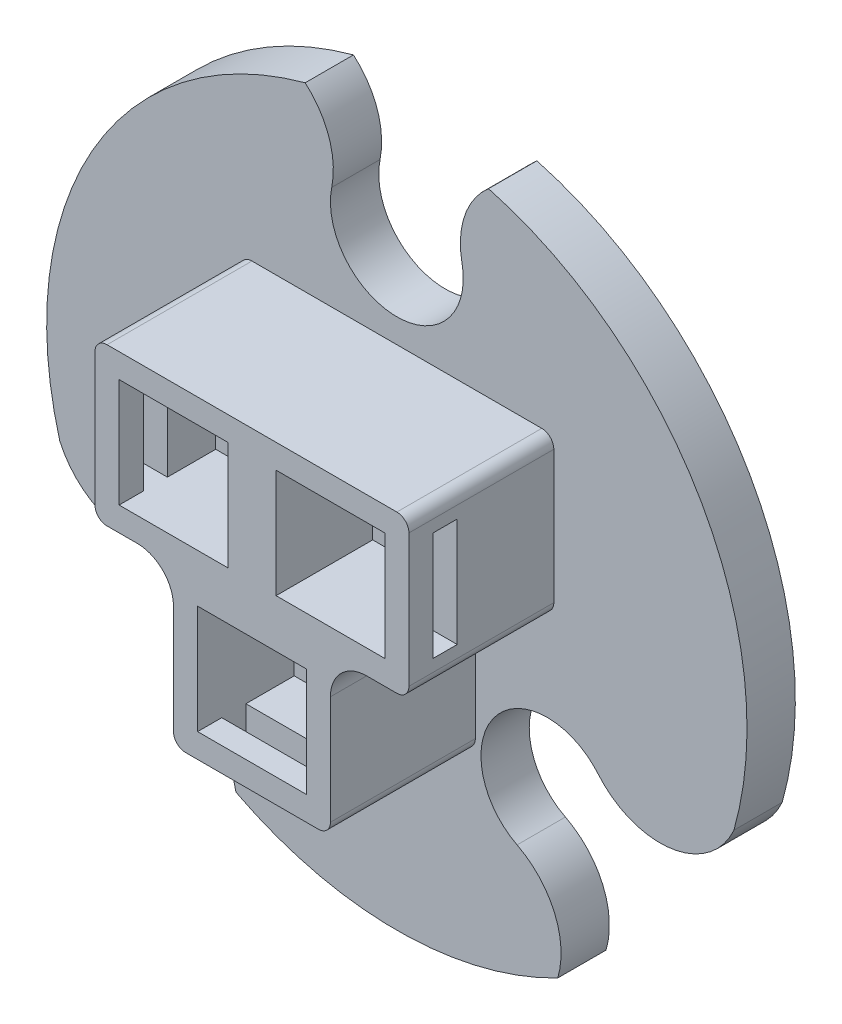
from build123d import *
from OCP.BRepFilletAPI import BRepFilletAPI_MakeFillet

# Parameters (mm, degrees)
SKETCH1_W           = 6.5
SKETCH1_H           = 6.5
BOSS_EXTRUDE1_DEPTH = 4
SKETCH5_W           = 6.5
SKETCH5_H           = 6.5
BOSS_EXTRUDE2_DEPTH = 8
SKETCH2_W           = 4.5
SKETCH2_H           = 4.5
CUT_EXTRUDE1_DEPTH  = 4
SKETCH10_W          = 1.75
SKETCH10_H          = 1.5
CUT_EXTRUDE3_DEPTH  = 11.024968828
FILLET7_R1          = 0.5
FILLET7_R2          = 1.5
BOSS_EXTRUDE3_DEPTH = 2
SKETCH12_W          = 1
SKETCH12_H          = 4.5
CUT_EXTRUDE4_DEPTH  = 5.5
SKETCH14_W          = 1
SKETCH14_H          = 4.5
CUT_EXTRUDE5_DEPTH  = 5.5
SKETCH15_W          = 4.5
SKETCH15_H          = 1
CUT_EXTRUDE6_DEPTH  = 5.5


with BuildPart() as part:
    # Sketch1 → Boss-Extrude1 (new, symmetric)
    with BuildSketch(Plane.XY):
        with Locations((3.25, 3.25)):
            Rectangle(SKETCH1_W, SKETCH1_H)
        with Locations((-3.25, 3.25)):
            Rectangle(SKETCH1_W, SKETCH1_H)
    extrude(amount=BOSS_EXTRUDE1_DEPTH, both=True)

    # Sketch5 → Boss-Extrude2 (add)
    with BuildSketch(Plane.XY.offset(4)):
        with Locations((0, -3.25)):
            Rectangle(SKETCH5_W, SKETCH5_H)
    extrude(amount=-BOSS_EXTRUDE2_DEPTH)

    # Sketch2 → Cut-Extrude1 (cut)
    with BuildSketch(Plane.XY.offset(4)):
        with Locations((3.25, 3.25)):
            Rectangle(SKETCH2_W, SKETCH2_H)
        with Locations((-3.25, 3.25)):
            Rectangle(SKETCH2_W, SKETCH2_H)
        with Locations((0, -3.25)):
            Rectangle(SKETCH2_W, SKETCH2_H)
    extrude(amount=-CUT_EXTRUDE1_DEPTH, mode=Mode.SUBTRACT)

    # Sketch10 → Cut-Extrude3 (cut, through all)
    with BuildSketch(Plane.XY):
        with Locations((1.875, 3.25)):
            Rectangle(SKETCH10_W, SKETCH10_H)
        with Locations((-4.625, 3.25)):
            Rectangle(SKETCH10_W, SKETCH10_H)
        with Locations((4.625, 3.25)):
            Rectangle(SKETCH10_W, SKETCH10_H)
        with Locations((-1.875, 3.25)):
            Rectangle(SKETCH10_W, SKETCH10_H)
        with Locations((-1.375, -3.25)):
            Rectangle(SKETCH10_W, SKETCH10_H)
        with Locations((1.375, -3.25)):
            Rectangle(SKETCH10_W, SKETCH10_H)
    extrude(amount=-CUT_EXTRUDE3_DEPTH, mode=Mode.SUBTRACT)

    # Fillet7: one fillet with a radius per group of edges: ONE call of the kernel's fillet builder (fillet() takes one radius for all edges)
    fillet7_edges_1 = [part.edges().sort_by_distance(p)[0] for p in [
        (-6.5, 0, 0),
        (-6.5, 6.5, 0),
        (6.5, 6.5, 0),
        (6.5, 0, 0),
        (-3.25, -6.5, 0),
        (3.25, -6.5, 0),
    ]]
    fillet7_edges_2 = [part.edges().sort_by_distance(p)[0] for p in [
        (-3.25, 0, 0),
        (3.25, 0, 0),
    ]]
    fillet7 = BRepFilletAPI_MakeFillet(part.part.solid().wrapped)
    for e in fillet7_edges_1:
        fillet7.Add(FILLET7_R1, e.wrapped)
    for e in fillet7_edges_2:
        fillet7.Add(FILLET7_R2, e.wrapped)
    add(Compound.cast(fillet7.Shape()), mode=Mode.REPLACE)

    # Sketch11 → Boss-Extrude3 (add)
    with BuildSketch(Plane.XY.offset(-4)):
        with BuildLine():
            ThreePointArc((-6.662391677, -12.878763029), (1.7135e-05, -14.5), (6.662422116, -12.878747282))
            ThreePointArc((6.662422116, -12.878747282), (6.529952292, -10.609320257), (4.978591095, -8.947656719))
            ThreePointArc((4.978591095, -8.947656719), (4.08034863, -4.787651774), (8.335817539, -4.728787212))
            ThreePointArc((8.335817539, -4.728787212), (11.36788446, -5.887108435), (13.95725976, -3.93))
            ThreePointArc((13.95725976, -3.93), (12.614166243, 7.150720942), (3.796390173, 13.994192426))
            ThreePointArc((3.796390173, 13.994192426), (2.811770094, 12.543018162), (2.695822199, 10.793178304))
            ThreePointArc((2.695822199, 10.793178304), (0, 7.5), (-2.695822199, 10.793178304))
            ThreePointArc((-2.695822199, 10.793178304), (-2.811770094, 12.543018162), (-3.796390173, 13.994192426))
            ThreePointArc((-3.796390173, 13.994192426), (-12.614205329, 7.150651992), (-13.957216796, -3.930152581))
            ThreePointArc((-13.957216796, -3.930152581), (-11.367821604, -5.887138898), (-8.335824842, -4.728795885))
            ThreePointArc((-8.335824842, -4.728795885), (-4.08035569, -4.787642902), (-4.978581003, -8.947651551))
            ThreePointArc((-4.978581003, -8.947651551), (-6.529938219, -10.609328183), (-6.662391677, -12.878763029))
        make_face()
        with BuildLine():
            Line((-3.25, -1.5), (-3.25, -6))
            ThreePointArc((-3.25, -6), (-3.103553391, -6.353553391), (-2.75, -6.5))
            Line((-2.75, -6.5), (2.75, -6.5))
            ThreePointArc((2.75, -6.5), (3.103553391, -6.353553391), (3.25, -6))
            Line((3.25, -6), (3.25, -1.5))
            ThreePointArc((3.25, -1.5), (3.689339828, -0.439339828), (4.75, 0))
            Line((4.75, 0), (6, 0))
            ThreePointArc((6, 0), (6.353553391, 0.146446609), (6.5, 0.5))
            Line((6.5, 0.5), (6.5, 6))
            ThreePointArc((6.5, 6), (6.353553391, 6.353553391), (6, 6.5))
            Line((6, 6.5), (-6, 6.5))
            ThreePointArc((-6, 6.5), (-6.353553391, 6.353553391), (-6.5, 6))
            Line((-6.5, 6), (-6.5, 0.5))
            ThreePointArc((-6.5, 0.5), (-6.353553391, 0.146446609), (-6, 0))
            Line((-6, 0), (-4.75, 0))
            ThreePointArc((-4.75, 0), (-3.689339828, -0.439339828), (-3.25, -1.5))
        make_face(mode=Mode.SUBTRACT)
    extrude(amount=BOSS_EXTRUDE3_DEPTH)

    # Sketch12 → Cut-Extrude4 (cut)
    with BuildSketch(Plane.ZY.offset(6.5)):
        with Locations((2.5, 3.25)):
            Rectangle(SKETCH12_W, SKETCH12_H)
    extrude(amount=-CUT_EXTRUDE4_DEPTH, mode=Mode.SUBTRACT)

    # Sketch14 → Cut-Extrude5 (cut)
    with BuildSketch(Plane(origin=(6.5, 0, 0), x_dir=(0, 0, -1), z_dir=(1, 0, 0))):
        with Locations((-2.5, 3.25)):
            Rectangle(SKETCH14_W, SKETCH14_H)
    extrude(amount=-CUT_EXTRUDE5_DEPTH, mode=Mode.SUBTRACT)

    # Sketch15 → Cut-Extrude6 (cut)
    with BuildSketch(Plane.XZ.offset(6.5)):
        with Locations((0, 2.5)):
            Rectangle(SKETCH15_W, SKETCH15_H)
    extrude(amount=-CUT_EXTRUDE6_DEPTH, mode=Mode.SUBTRACT)


solid = part.part
